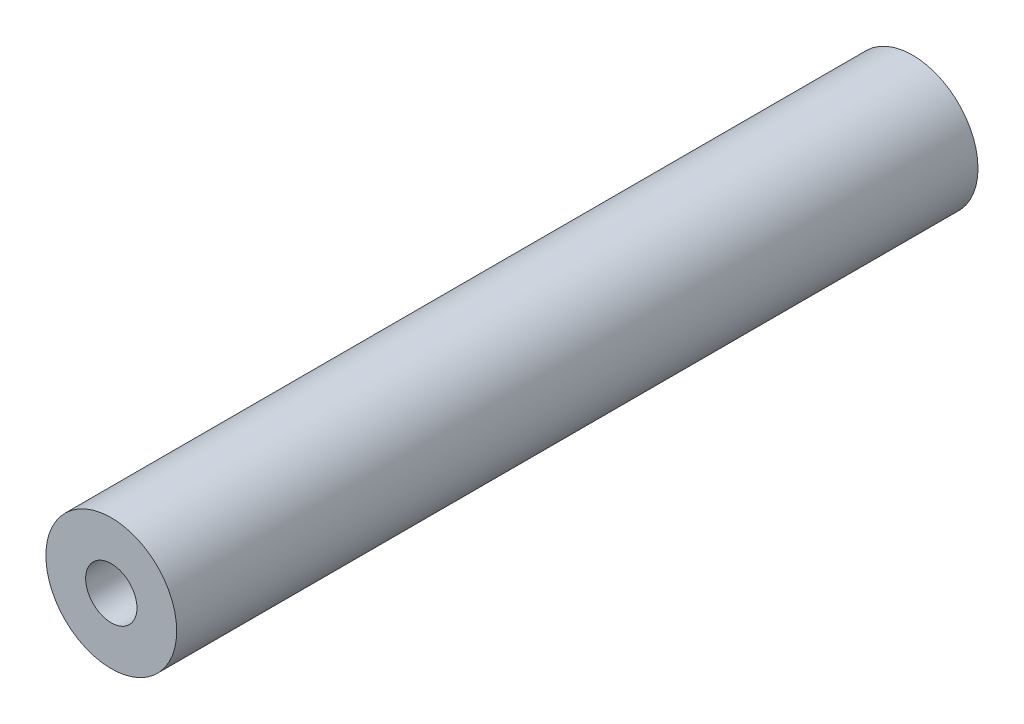
from build123d import *

# Parameters (mm, degrees)
SKETCH1_R           = 6.35
SKETCH1_R_2         = 2.4892
BOSS_EXTRUDE1_DEPTH = 77.7875


with BuildPart() as part:
    # Sketch1 → Boss-Extrude1 (new body)
    with BuildSketch(Plane.XY):
        Circle(SKETCH1_R)
        Circle(SKETCH1_R_2, mode=Mode.SUBTRACT)
    extrude(amount=BOSS_EXTRUDE1_DEPTH)


solid = part.part
